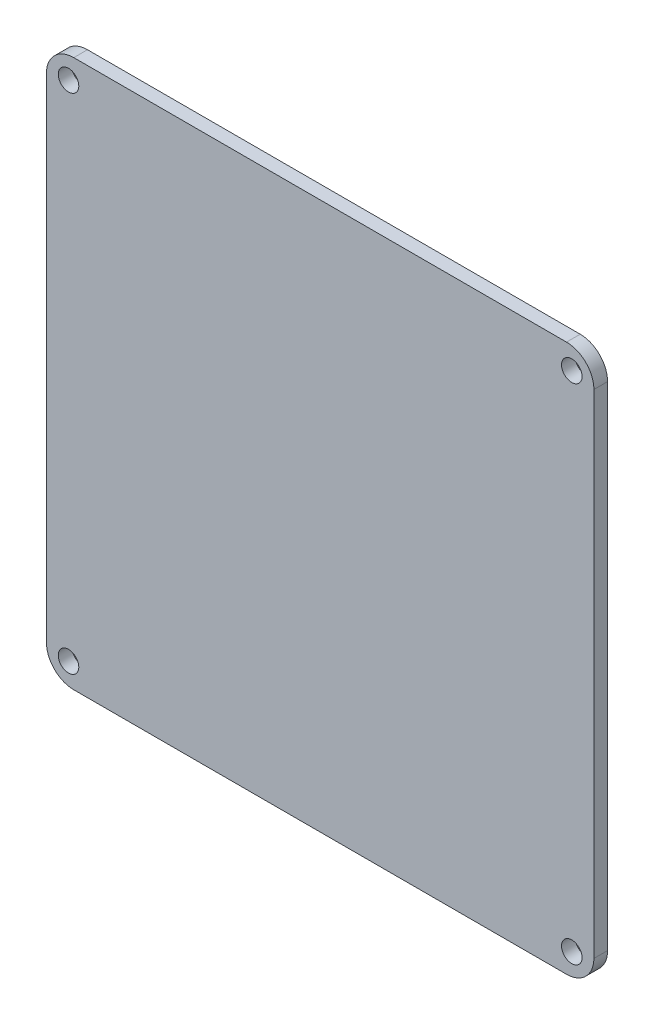
from build123d import *

# Parameters (mm, degrees)
SKETCH1_R           = 2
BOSS_EXTRUDE1_DEPTH = 5
CUT_EXTRUDE1_REACH  = 143.51
SKETCH2_R           = 3.75


with BuildPart() as part:
    # Sketch1 → Boss-Extrude1 (new body)
    with BuildSketch(Plane.XY):
        with BuildLine():
            Line((-90, -100), (90, -100))
            ThreePointArc((90, -100), (97.071067812, -97.071067812), (100, -90))
            Line((100, -90), (100, 90))
            ThreePointArc((100, 90), (97.071067812, 97.071067812), (90, 100))
            Line((90, 100), (-90, 100))
            ThreePointArc((-90, 100), (-97.071067812, 97.071067812), (-100, 90))
            Line((-100, 90), (-100, -90))
            ThreePointArc((-100, -90), (-97.071067812, -97.071067812), (-90, -100))
        make_face()
        with Locations((-91.923881554, 91.923881554)):
            Circle(SKETCH1_R, mode=Mode.SUBTRACT)
        with Locations((91.923881554, 91.923881554)):
            Circle(SKETCH1_R, mode=Mode.SUBTRACT)
        with Locations((-91.923881554, -91.923881554)):
            Circle(SKETCH1_R, mode=Mode.SUBTRACT)
        with Locations((91.923881554, -91.923881554)):
            Circle(SKETCH1_R, mode=Mode.SUBTRACT)
    extrude(amount=BOSS_EXTRUDE1_DEPTH)

    # Sketch2 → Cut-Extrude1 (cut, up to next)
    with BuildSketch(Plane.XY.offset(5), mode=Mode.PRIVATE) as cut_extrude1_sk1:
        with Locations((91.923881554, 91.923881554)):
            Circle(SKETCH2_R)
    cut_extrude1_tool1 = extrude(cut_extrude1_sk1.sketch, amount=-CUT_EXTRUDE1_REACH, mode=Mode.PRIVATE) & part.part
    # Sketch2 → Cut-Extrude1 (cut, up to next)
    with BuildSketch(Plane.XY.offset(5), mode=Mode.PRIVATE) as cut_extrude1_sk2:
        with Locations((-91.923881554, 91.923881554)):
            Circle(SKETCH2_R)
    cut_extrude1_tool2 = extrude(cut_extrude1_sk2.sketch, amount=-CUT_EXTRUDE1_REACH, mode=Mode.PRIVATE) & part.part
    # Sketch2 → Cut-Extrude1 (cut, up to next)
    with BuildSketch(Plane.XY.offset(5), mode=Mode.PRIVATE) as cut_extrude1_sk3:
        with Locations((-91.923881554, -91.923881554)):
            Circle(SKETCH2_R)
    cut_extrude1_tool3 = extrude(cut_extrude1_sk3.sketch, amount=-CUT_EXTRUDE1_REACH, mode=Mode.PRIVATE) & part.part
    # Sketch2 → Cut-Extrude1 (cut, up to next)
    with BuildSketch(Plane.XY.offset(5), mode=Mode.PRIVATE) as cut_extrude1_sk4:
        with Locations((91.923881554, -91.923881554)):
            Circle(SKETCH2_R)
    cut_extrude1_tool4 = extrude(cut_extrude1_sk4.sketch, amount=-CUT_EXTRUDE1_REACH, mode=Mode.PRIVATE) & part.part
    add(cut_extrude1_tool1.solids().sort_by_distance((91.923882, 91.923882, 5))[0], mode=Mode.SUBTRACT)
    add(cut_extrude1_tool2.solids().sort_by_distance((-91.923882, 91.923882, 5))[0], mode=Mode.SUBTRACT)
    add(cut_extrude1_tool3.solids().sort_by_distance((-91.923882, -91.923882, 5))[0], mode=Mode.SUBTRACT)
    add(cut_extrude1_tool4.solids().sort_by_distance((91.923882, -91.923882, 5))[0], mode=Mode.SUBTRACT)


solid = part.part
